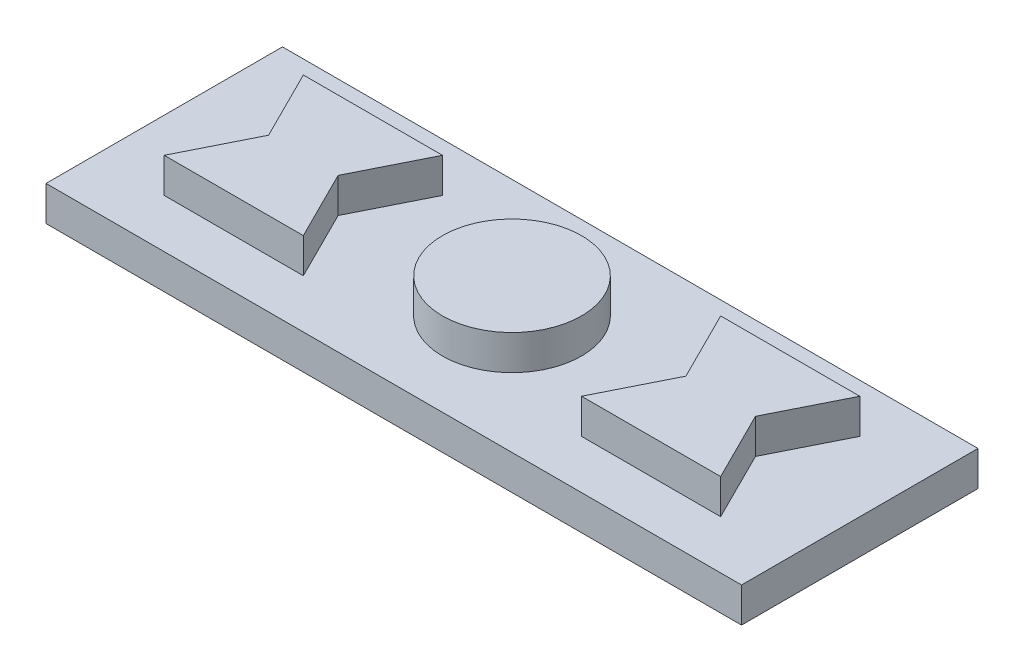
from build123d import *

# Parameters (mm, degrees)
SKETCH_1_W      = 100
SKETCH_1_H      = 34
SKETCH_1_R      = 10
EXTRUDE_1_DEPTH = 5
SKETCH_1_2_R    = 10
EXTRUDE_2_DEPTH = 10


with BuildPart() as part:
    # 草图1 → 凸台-拉伸1 (new body)
    with BuildSketch(Plane(origin=(0, 0, 0), x_dir=(1, 0, 0), z_dir=(0, 1, 0))):
        Rectangle(SKETCH_1_W, SKETCH_1_H)
        Circle(SKETCH_1_R, mode=Mode.SUBTRACT)
        Polygon((-40, 10), (-20, 10), (-25, 0), (-20, -10), (-40, -10), (-35, 0), align=None, mode=Mode.SUBTRACT)
        Polygon((40, 10), (20, 10), (25, 0), (20, -10), (40, -10), (35, 0), align=None, mode=Mode.SUBTRACT)
    extrude(amount=EXTRUDE_1_DEPTH)

    # 草图1<2> → 凸台-拉伸2 (add)
    with BuildSketch(Plane(origin=(0, 0, 0), x_dir=(1, 0, 0), z_dir=(0, 1, 0))):
        Polygon((-20, 10), (-40, 10), (-35, 0), (-40, -10), (-20, -10), (-25, 0), align=None)
        Polygon((35, 0), (40, 10), (20, 10), (25, 0), (20, -10), (40, -10), align=None)
        Circle(SKETCH_1_2_R)
    extrude(amount=EXTRUDE_2_DEPTH)


solid = part.part
